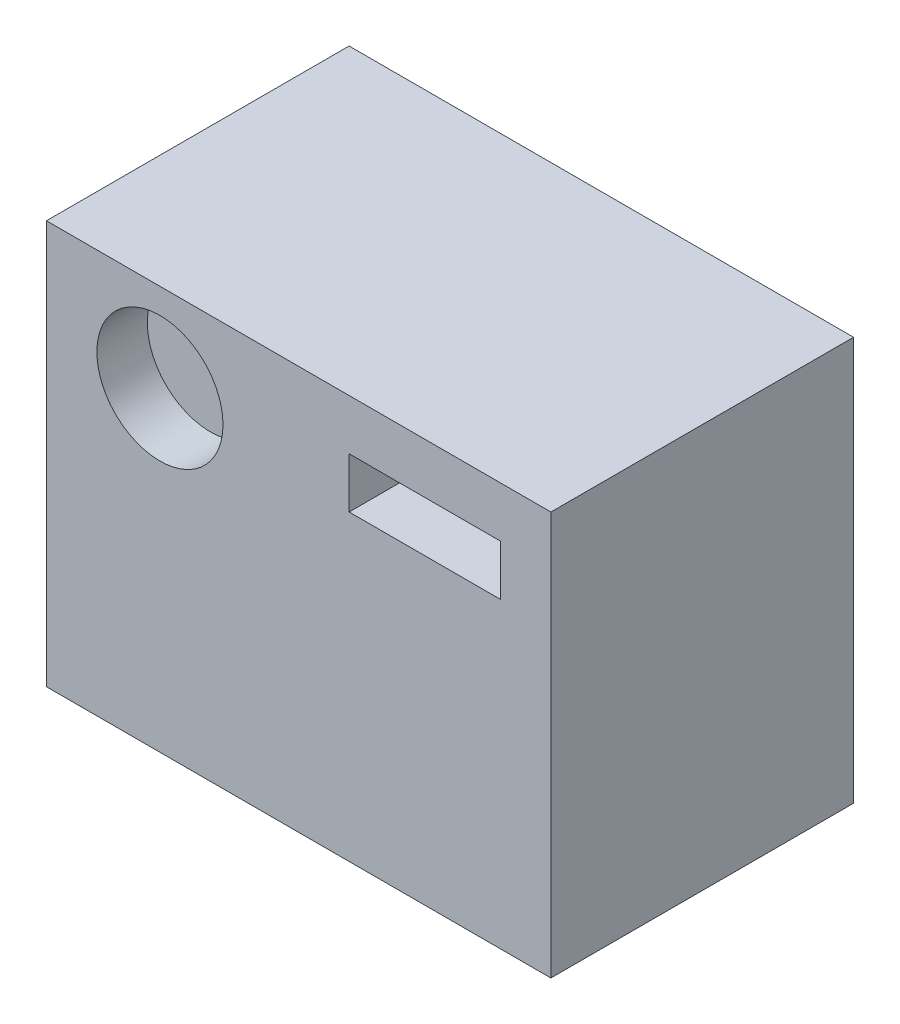
from build123d import *

# Parameters (mm, degrees)
CROQUIS1_W              = 20
CROQUIS1_H              = 16
SALIENTE_EXTRUIR1_DEPTH = 12
CROQUIS2_R              = 2.5
CROQUIS2_W              = 6
CROQUIS2_H              = 2
CORTAR_EXTRUIR1_DEPTH   = 2


with BuildPart() as part:
    # Croquis1 → Saliente-Extruir1 (new body)
    with BuildSketch(Plane.XY):
        with Locations((10, 8)):
            Rectangle(CROQUIS1_W, CROQUIS1_H)
    extrude(amount=SALIENTE_EXTRUIR1_DEPTH)

    # Croquis2 → Cortar-Extruir1 (cut)
    with BuildSketch(Plane.XY.offset(12)):
        with Locations((4.5, 12.5)):
            Circle(CROQUIS2_R)
        with Locations((15, 13)):
            Rectangle(CROQUIS2_W, CROQUIS2_H)
    extrude(amount=-CORTAR_EXTRUIR1_DEPTH, mode=Mode.SUBTRACT)


solid = part.part
